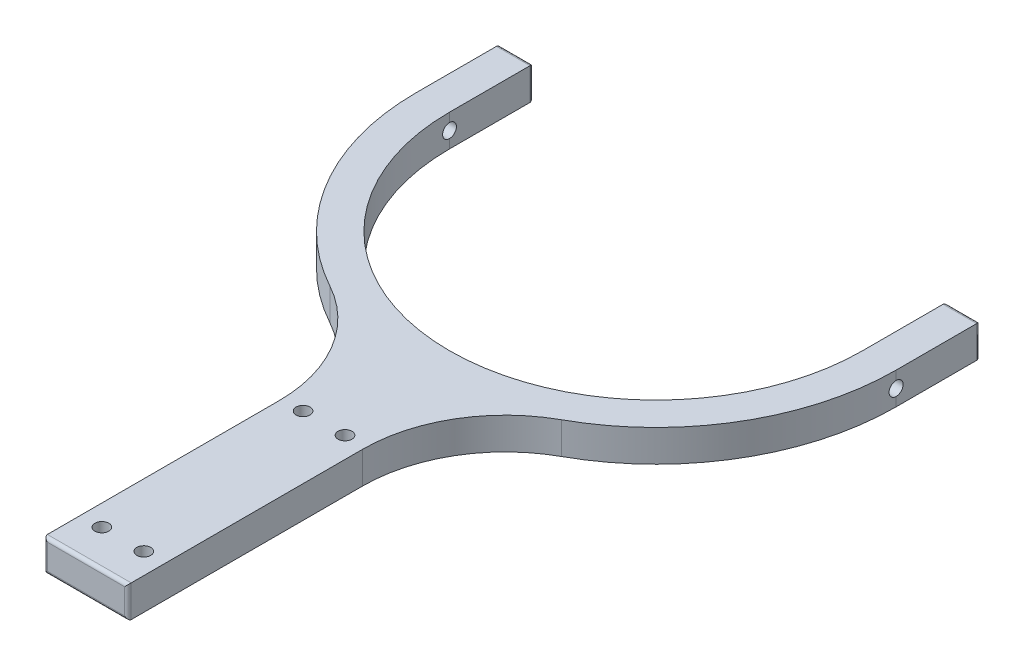
from build123d import *

# Parameters (mm, degrees)
RESSALTO_EXTRUS_O1_DEPTH                       = 19
FILETE2_R                                      = 2
FILETE3_R                                      = 2
FILETE4_R                                      = 2
FURO_ROSCADO_PARA_CONDU_TE_DE_M8X1_252_D       = 8.3
FURO_ROSCADO_PARA_CONDU_TE_DE_M8X1_251_D       = 8.3
FURO_ROSCADO_PARA_CONDU_TE_DE_M8X1_251_DEPTH   = 25
FURO_ROSCADO_PARA_CONDU_TE_DE_M8X1_251_TIP     = 2.493571569
FURO_ROSCADO_PARA_CONDU_TE_DE_M8X1_251_O_D     = 8.3
FURO_ROSCADO_PARA_CONDU_TE_DE_M8X1_251_O_DEPTH = 25
FURO_ROSCADO_PARA_CONDU_TE_DE_M8X1_251_O_TIP   = 2.493571569


with BuildPart() as part:
    # Esboço2 → Ressalto-extrusão1 (new body)
    with BuildSketch(Plane(origin=(0, 0, 0), x_dir=(1, 0, 0), z_dir=(0, 1, 0))):
        with BuildLine():
            Line((-25, -200), (-25, -340))
            Line((-25, -340), (25, -340))
            Line((25, -340), (25, -200))
            ThreePointArc((25, -200), (36.838728685, -156.699788653), (69.061196889, -125.446367362))
            ThreePointArc((69.061196889, -125.446367362), (123.279770024, -72.858344084), (143.2, 0))
            Line((143.2, 0), (143.2, 50))
            Line((143.2, 50), (123.2, 50))
            Line((123.2, 50), (123.2, 0))
            ThreePointArc((123.2, 0), (0, -123.2), (-123.2, 0))
            Line((-123.2, 0), (-123.2, 50))
            Line((-123.2, 50), (-143.2, 50))
            Line((-143.2, 50), (-143.2, 0))
            ThreePointArc((-143.2, 0), (-123.279770024, -72.858344084), (-69.061196889, -125.446367362))
            ThreePointArc((-69.061196889, -125.446367362), (-36.838728685, -156.699788653), (-25, -200))
        make_face()
    extrude(amount=RESSALTO_EXTRUS_O1_DEPTH)

    # Filete2
    filete2_edges = [part.edges().sort_by_distance(p)[0] for p in [
        (-133.2, 19, -50),
        (-133.2, 0, -50),
        (-143.2, 9.5, -50),
        (-123.2, 9.5, -50),
    ]]
    fillet(filete2_edges, radius=FILETE2_R)

    # Filete3
    filete3_edges = [part.edges().sort_by_distance(p)[0] for p in [
        (133.2, 0, -50),
        (123.2, 9.5, -50),
        (143.2, 9.5, -50),
        (133.2, 19, -50),
    ]]
    fillet(filete3_edges, radius=FILETE3_R)

    # Filete4
    filete4_edges = [part.edges().sort_by_distance(p)[0] for p in [
        (0, 0, 340),
        (25, 9.5, 340),
        (-25, 9.5, 340),
        (0, 19, 340),
    ]]
    fillet(filete4_edges, radius=FILETE4_R)

    # Furo roscado para conduíte de M8x1.252 (through all)
    with Locations(Plane(origin=(-12.5, 19, 318), x_dir=(0, 0, 1), z_dir=(0, 1, 0))):
        with Locations((0, 0), (0, 25), (-120, 25), (-120, 0)):
            Hole(FURO_ROSCADO_PARA_CONDU_TE_DE_M8X1_252_D / 2)

    # Furo roscado para conduíte de M8x1.251
    with Locations(Plane(origin=(143.2, 9.5, 0), x_dir=(0, 0, 1), z_dir=(1, 0, 0))):
        with Locations((0, 0)):
            Hole(FURO_ROSCADO_PARA_CONDU_TE_DE_M8X1_251_D / 2, depth=FURO_ROSCADO_PARA_CONDU_TE_DE_M8X1_251_DEPTH)
            with Locations((0, 0, -(FURO_ROSCADO_PARA_CONDU_TE_DE_M8X1_251_DEPTH + FURO_ROSCADO_PARA_CONDU_TE_DE_M8X1_251_TIP / 2))):  # 118° drill point
                Cone(0, FURO_ROSCADO_PARA_CONDU_TE_DE_M8X1_251_D / 2, FURO_ROSCADO_PARA_CONDU_TE_DE_M8X1_251_TIP, mode=Mode.SUBTRACT)

    # Furo roscado para conduíte de M8x1.251 o
    with Locations(Plane(origin=(-143.2, 9.5, 0), x_dir=(0, 0, -1), z_dir=(-1, 0, 0))):
        with Locations((0, 0)):
            Hole(FURO_ROSCADO_PARA_CONDU_TE_DE_M8X1_251_O_D / 2, depth=FURO_ROSCADO_PARA_CONDU_TE_DE_M8X1_251_O_DEPTH)
            with Locations((0, 0, -(FURO_ROSCADO_PARA_CONDU_TE_DE_M8X1_251_O_DEPTH + FURO_ROSCADO_PARA_CONDU_TE_DE_M8X1_251_O_TIP / 2))):  # 118° drill point
                Cone(0, FURO_ROSCADO_PARA_CONDU_TE_DE_M8X1_251_O_D / 2, FURO_ROSCADO_PARA_CONDU_TE_DE_M8X1_251_O_TIP, mode=Mode.SUBTRACT)


solid = part.part
